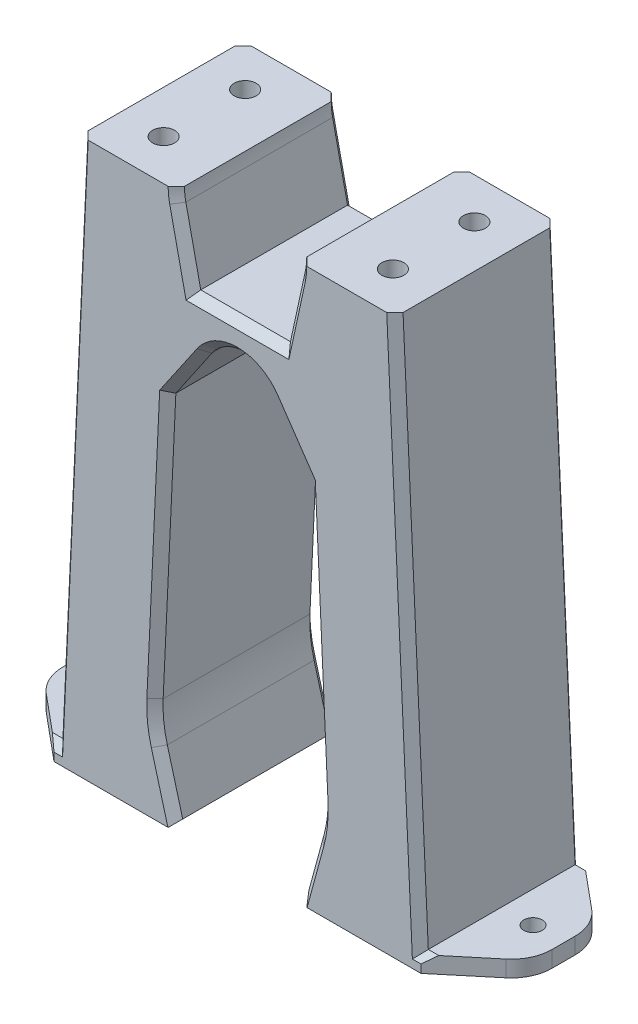
from build123d import *
from OCP.BRepFilletAPI import BRepFilletAPI_MakeChamfer

# Parameters (mm, degrees)
ESTRUSIONE_ESTRUSIONE1_DEPTH = 40
FORO_PER_VITE_M4_1_D         = 5.4
FORO_PER_VITE_M4_1_DEPTH     = 15
FORO_PER_VITE_M4_1_TIP       = 1.622323671
ESTRUSIONE_ESTRUSIONE2_DEPTH = 4
FORO_PER_VITE_M4_2_D         = 4.5
FORO_PER_VITE_M4_2_DEPTH     = 80
FORO_PER_VITE_M4_2_TIP       = 1.351936393
RACCORDO1_R                  = 10
RACCORDO2_R                  = 30
SMUSSO1_SIZE                 = 2
SMUSSO1_SIZE2                = 1.629150908


with BuildPart() as part:
    # Schizzo1 → Estrusione-Estrusione1 (new body)
    with BuildSketch(Plane.XY):
        with BuildLine():
            Line((-14.657188407, -3.188546376), (-11, -20))
            Line((-11, -20), (11, -20))
            Line((11, -20), (14.657188407, -3.188546376))
            ThreePointArc((14.657188407, -3.188546376), (14.91405086, -1.603460927), (15, 0))
            Line((15, 0), (38.615528128, 0))
            Line((38.615528128, 0), (44.812497155, -132.20000012))
            Line((44.812497155, -132.20000012), (45, -132.20000012))
            Line((45, -132.20000012), (45, -136.20000012))
            Line((45, -136.20000012), (15, -136.20000012))
            Line((15, -136.20000012), (20.446957648, -116.20000012))
            Line((20.446957648, -116.20000012), (17.109407004, -45))
            Line((17.109407004, -45), (8.25243508, -32.058330072))
            ThreePointArc((8.25243508, -32.058330072), (0, -27.706100894), (-8.25243508, -32.058330072))
            Line((-8.25243508, -32.058330072), (-17.109407004, -45))
            Line((-17.109407004, -45), (-20.446957648, -116.20000012))
            Line((-20.446957648, -116.20000012), (-15, -136.20000012))
            Line((-15, -136.20000012), (-45, -136.20000012))
            Line((-45, -136.20000012), (-45, -132.20000012))
            Line((-45, -132.20000012), (-44.812497155, -132.20000012))
            Line((-44.812497155, -132.20000012), (-38.615528128, 0))
            Line((-38.615528128, 0), (-15, 0))
            ThreePointArc((-15, 0), (-14.91405086, -1.603460927), (-14.657188407, -3.188546376))
        make_face()
    extrude(amount=ESTRUSIONE_ESTRUSIONE1_DEPTH)

    # Foro per Vite M4-1
    with Locations(Plane(origin=(0, 0, 0), x_dir=(1, 0, 0), z_dir=(0, 1, 0))):
        with Locations((-28.115528128, -10), (-28.115528128, -30), (28.115528128, -30), (28.115528128, -10)):
            Hole(FORO_PER_VITE_M4_1_D / 2, depth=FORO_PER_VITE_M4_1_DEPTH)
            with Locations((0, 0, -(FORO_PER_VITE_M4_1_DEPTH + FORO_PER_VITE_M4_1_TIP / 2))):  # 118° drill point
                Cone(0, FORO_PER_VITE_M4_1_D / 2, FORO_PER_VITE_M4_1_TIP, mode=Mode.SUBTRACT)

    # Schizzo6 → Estrusione-Estrusione2 (add)
    with BuildSketch(Plane.XZ.offset(136.20000012)):
        Polygon((-45, 40), (-60, 27.5), (-60, 12.5), (-45, 0), align=None)
        Polygon((45, 40), (60, 27.5), (60, 12.5), (45, 0), align=None)
    extrude(amount=-ESTRUSIONE_ESTRUSIONE2_DEPTH)

    # Foro per Vite M4-2
    with Locations(Plane(origin=(0, -132.20000012, 0), x_dir=(1, 0, 0), z_dir=(0, 1, 0))):
        with Locations((-52.5, -20), (52.5, -20)):
            Hole(FORO_PER_VITE_M4_2_D / 2, depth=FORO_PER_VITE_M4_2_DEPTH)
            with Locations((0, 0, -(FORO_PER_VITE_M4_2_DEPTH + FORO_PER_VITE_M4_2_TIP / 2))):  # 118° drill point
                Cone(0, FORO_PER_VITE_M4_2_D / 2, FORO_PER_VITE_M4_2_TIP, mode=Mode.SUBTRACT)

    # Raccordo1
    raccordo1_edges = [part.edges().sort_by_distance(p)[0] for p in [
        (-60, -134.20000012, 12.5),
        (-60, -134.20000012, 27.5),
        (60, -134.20000012, 27.5),
        (60, -134.20000012, 12.5),
    ]]
    fillet(raccordo1_edges, radius=RACCORDO1_R)

    # Raccordo2
    raccordo2_edges = [part.edges().sort_by_distance(p)[0] for p in [
        (-20.446957648, -116.20000012, 20),
        (20.446957648, -116.20000012, 20),
    ]]
    fillet(raccordo2_edges, radius=RACCORDO2_R)

    # Smusso1: one chamfer whose edges measure the first distance from different faces: ONE call of the kernel's chamfer builder (chamfer() names one face for all edges)
    smusso1_edges_1 = [part.edges().sort_by_distance(p)[0] for p in [
        (-18.667449483, -78.237735256, 40),
        (12.680921042, -38.529165036, 40),
        (-12.680921042, -38.529165036, 40),
        (17.102049114, -128.481749861, 0),
        (17.102049114, -128.481749861, 40),
        (-17.102049114, -128.481749861, 0),
        (-17.102049114, -128.481749861, 40),
        (20.078629399, -116.159495492, 0),
        (20.078629399, -116.159495492, 40),
        (-20.078629399, -116.159495492, 0),
        (-20.078629399, -116.159495492, 40),
        (18.667449483, -78.237735256, 40),
        (-18.667449483, -78.237735256, 0),
        (-44.906248578, -132.20000012, 0),
        (-41.714012642, -66.10000006, 0),
        (-14.91405086, -1.603460927, 0),
        (-12.828594204, -11.594273188, 0),
        (0, -20, 0),
        (12.828594204, -11.594273188, 0),
        (14.91405086, -1.603460927, 0),
        (41.714012642, -66.10000006, 0),
        (44.906248578, -132.20000012, 0),
        (18.667449483, -78.237735256, 0),
        (44.906248578, -132.20000012, 40),
        (41.714012642, -66.10000006, 40),
        (14.91405086, -1.603460927, 40),
        (12.828594204, -11.594273188, 40),
        (0, -27.706100894, 40),
        (0, -20, 40),
        (-12.828594204, -11.594273188, 40),
        (-14.91405086, -1.603460927, 40),
        (-41.714012642, -66.10000006, 40),
        (-44.906248578, -132.20000012, 40),
    ]]
    smusso1_edges_2 = [part.edges().sort_by_distance(p)[0] for p in [
        (-15, -136.20000012, 20),
    ]]
    smusso1_side_2 = [part.faces().sort_by_distance(p)[0] for p in [
        (-35.203995695, -136.20000012, 20),
    ]]
    smusso1_edges_3 = [part.edges().sort_by_distance(p)[0] for p in [
        (15, -136.20000012, 20),
    ]]
    smusso1_side_3 = [part.faces().sort_by_distance(p)[0] for p in [
        (17.102049114, -128.481749861, 20),
    ]]
    smusso1 = BRepFilletAPI_MakeChamfer(part.part.solid().wrapped)
    for e in smusso1_edges_1:
        smusso1.Add(SMUSSO1_SIZE, e.wrapped)
    for e in smusso1_edges_2:
        smusso1.Add(SMUSSO1_SIZE, SMUSSO1_SIZE2, e.wrapped, smusso1_side_2[0].wrapped)  # the first distance lies on this face
    for e in smusso1_edges_3:
        smusso1.Add(SMUSSO1_SIZE, SMUSSO1_SIZE2, e.wrapped, smusso1_side_3[0].wrapped)  # the first distance lies on this face
    add(Compound.cast(smusso1.Shape()), mode=Mode.REPLACE)


solid = part.part
